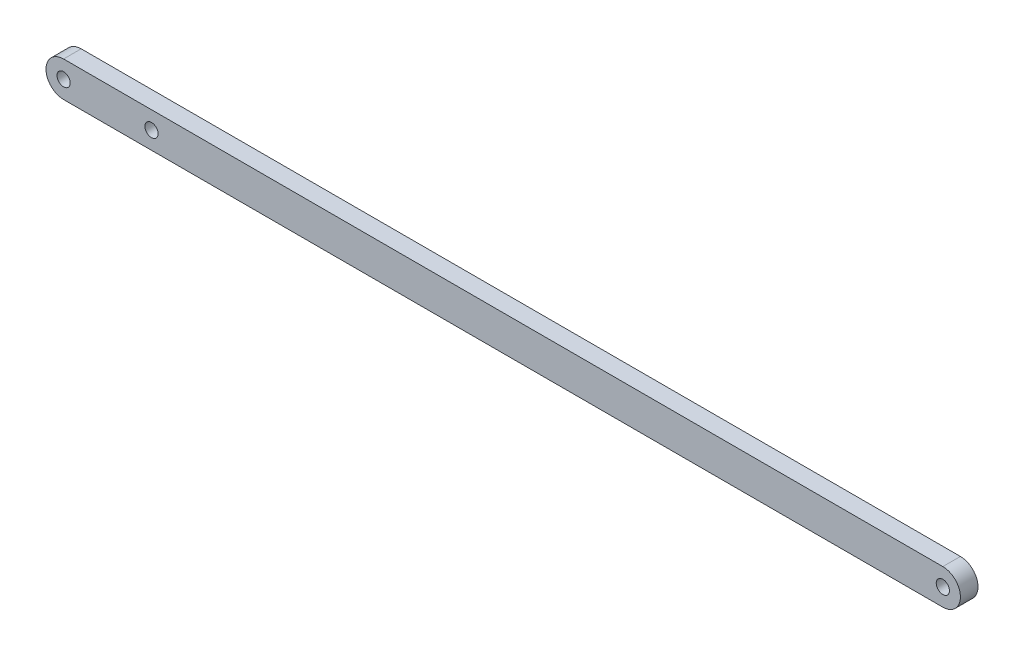
from build123d import *

# Parameters (mm, degrees)
SKETCH1_R           = 1.5
BOSS_EXTRUDE1_DEPTH = 4


with BuildPart() as part:
    # Sketch1 → Boss-Extrude1 (new body)
    with BuildSketch(Plane.XY):
        with BuildLine():
            Line((159.757575758, -4), (-40.242424242, -4))
            ThreePointArc((-40.242424242, -4), (-44.242424242, 0), (-40.242424242, 4))
            Line((-40.242424242, 4), (159.757575758, 4))
            ThreePointArc((159.757575758, 4), (163.757575758, 0), (159.757575758, -4))
        make_face()
        with Locations((-20.242424242, 0)):
            Circle(SKETCH1_R, mode=Mode.SUBTRACT)
        with Locations((-40.242424242, 0)):
            Circle(SKETCH1_R, mode=Mode.SUBTRACT)
        with Locations((159.757575758, 0)):
            Circle(SKETCH1_R, mode=Mode.SUBTRACT)
    extrude(amount=BOSS_EXTRUDE1_DEPTH)


solid = part.part
